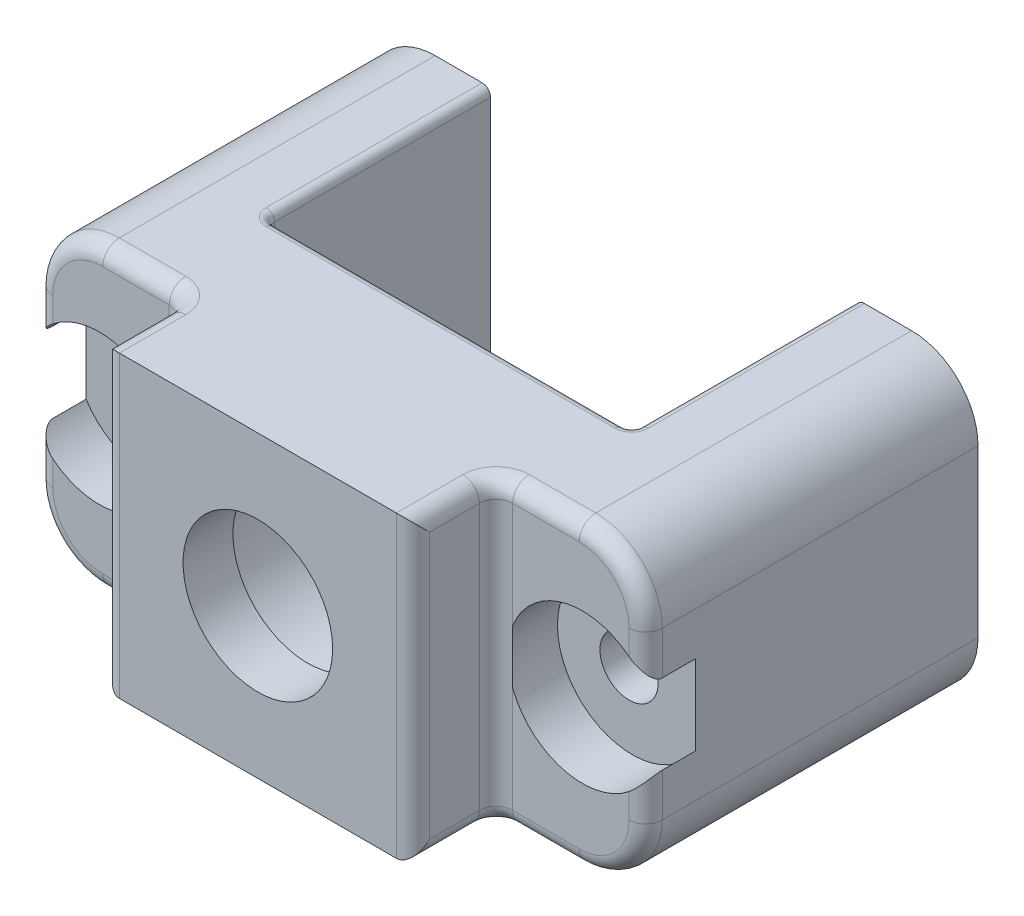
from build123d import *

# Parameters (mm, degrees)
SKETCH1_R            = 5.5
SKETCH1_R_2          = 1.75
BOSS_EXTRUDE1_DEPTH  = 15
SKETCH3_W            = 9.999397818
SKETCH3_H            = 22.225224056
CUT_EXTRUDE1_DEPTH   = 5
FILLET1_R            = 1
FILLET1_OF_MIRROR1_R = 1
SKETCH4_R            = 7.5
BOSS_EXTRUDE2_DEPTH  = 3
SKETCH5_W            = 22
SKETCH5_H            = 7
CUT_EXTRUDE2_DEPTH   = 30.75172255
SKETCH6_R            = 4.5
CUT_EXTRUDE3_DEPTH   = 26.34097462
SKETCH7_R            = 4.5
CUT_EXTRUDE8_DEPTH   = 3
FILLET3_R            = 0.5
FILLET2_R            = 0.5
BOSS_EXTRUDE3_START  = 10
SKETCH8_R            = 1.75
BOSS_EXTRUDE3_DEPTH  = 10


with BuildPart() as part:
    # Sketch1 → Boss-Extrude1 (new body)
    with BuildSketch(Plane.XY):
        with BuildLine():
            Line((-14.334802826, 9), (14.334802826, 9))
            ThreePointArc((14.334802826, 9), (17.163229951, 7.828427125), (18.334802826, 5))
            Line((18.334802826, 5), (18.334802826, -5))
            ThreePointArc((18.334802826, -5), (17.163229951, -7.828427125), (14.334802826, -9))
            Line((14.334802826, -9), (-14.334802826, -9))
            ThreePointArc((-14.334802826, -9), (-17.163229951, -7.828427125), (-18.334802826, -5))
            Line((-18.334802826, -5), (-18.334802826, 5))
            ThreePointArc((-18.334802826, 5), (-17.163229951, 7.828427125), (-14.334802826, 9))
        make_face()
        Circle(SKETCH1_R, mode=Mode.SUBTRACT)
        with Locations((-14.334802826, 0)):
            Circle(SKETCH1_R_2, mode=Mode.SUBTRACT)
        with Locations(Location((14.334802826, 0, 0), (0, 0, 180))):
            Circle(SKETCH1_R_2, mode=Mode.SUBTRACT)
    extrude(amount=BOSS_EXTRUDE1_DEPTH)

    # Sketch3 → Cut-Extrude1 (cut)
    with BuildSketch(Plane.XY.offset(15)):
        with Locations((-14.334501735, -0.429661625)):
            Rectangle(SKETCH3_W, SKETCH3_H)
    cut_extrude1 = extrude(amount=-CUT_EXTRUDE1_DEPTH, mode=Mode.SUBTRACT)

    # Fillet1
    fillet1_edges = [part.edges().sort_by_distance(p)[0] for p in [
        (-9.334802826, -9, 12.5),
        (-9.334802826, 0, 10),
        (-9.334802826, 9, 12.5),
        (-17.163229951, 7.828427125, 10),
        (-11.834802826, 9, 10),
        (-11.834802826, -9, 10),
        (-17.163229951, -7.828427125, 10),
        (-18.334802826, 0, 10),
        (-9.334802826, 0, 15),
    ]]
    fillet(fillet1_edges, radius=FILLET1_R)

    # Mirror1: Cut-Extrude1 across plane
    add(cut_extrude1.mirror(Plane(origin=(0, 0, 0), x_dir=(0, 0, 1), z_dir=(1, 0, 0))), mode=Mode.SUBTRACT)

    # Fillet1 of Mirror1
    fillet1_of_mirror1_edges = [part.edges().sort_by_distance(p)[0] for p in [
        (9.334802826, -9, 12.5),
        (9.334802826, 0, 10),
        (9.334802826, 9, 12.5),
        (17.163229951, 7.828427125, 10),
        (11.834802826, 9, 10),
        (11.834802826, -9, 10),
        (17.163229951, -7.828427125, 10),
        (18.334802826, 0, 10),
        (9.334802826, 0, 15),
    ]]
    fillet(fillet1_of_mirror1_edges, radius=FILLET1_OF_MIRROR1_R)

    # Sketch4 → Boss-Extrude2 (add)
    with BuildSketch(Plane.XY.offset(15)):
        Circle(SKETCH4_R)
    extrude(amount=-BOSS_EXTRUDE2_DEPTH)

    # Sketch5 → Cut-Extrude2 (cut, through all)
    with BuildSketch(Plane(origin=(0, 9, 0), x_dir=(1, 0, 0), z_dir=(0, 1, 0))):
        Rectangle(SKETCH5_W, SKETCH5_H)
    extrude(amount=-CUT_EXTRUDE2_DEPTH, mode=Mode.SUBTRACT)

    # Sketch6 → Cut-Extrude3 (cut, through all)
    with BuildSketch(Plane.XY.offset(15)):
        Circle(SKETCH6_R)
    extrude(amount=-CUT_EXTRUDE3_DEPTH, mode=Mode.SUBTRACT)

    # Sketch7 → Cut-Extrude8 (cut)
    with BuildSketch(Plane.XY.offset(10)):
        with Locations((-14.530374954, 0)):
            Circle(SKETCH7_R)
        with Locations((14.530374954, 0)):
            Circle(SKETCH7_R)
    extrude(amount=-CUT_EXTRUDE8_DEPTH, mode=Mode.SUBTRACT)

    # Fillet3
    fillet3_edges = [part.edges().sort_by_distance(p)[0] for p in [
        (11, -9, 1.75),
        (0, -9, 3.5),
        (11, 0, 3.5),
        (-11, -9, 1.75),
        (-11, 0, 3.5),
        (-11, 9, 1.75),
        (0, 9, 3.5),
        (11, 9, 1.75),
    ]]
    fillet(fillet3_edges, radius=FILLET3_R)

    # Fillet2
    fillet2_edges = [part.edges().sort_by_distance(p)[0] for p in [
        (-5.5, 0, 12),
    ]]
    fillet(fillet2_edges, radius=FILLET2_R)

    # Sketch8 → Boss-Extrude3 (add)
    # profile 1 of 2: a face of its own
    with BuildSketch(Plane(origin=(0, 0, 0), x_dir=(-1, 0, 0), z_dir=(0, 0, -1)).offset(BOSS_EXTRUDE3_START)):
        with BuildLine():
            Line((11, 8.5), (11, -8.5))
            ThreePointArc((11, -8.5), (11.146446609, -8.853553391), (11.5, -9))
            Line((11.5, -9), (14.334802826, -9))
            ThreePointArc((14.334802826, -9), (17.163229951, -7.828427125), (18.334802826, -5))
            Line((18.334802826, -5), (18.334802826, 5))
            ThreePointArc((18.334802826, 5), (17.163229951, 7.828427125), (14.334802826, 9))
            Line((14.334802826, 9), (11.5, 9))
            ThreePointArc((11.5, 9), (11.146446609, 8.853553391), (11, 8.5))
        make_face()
        with Locations((14.334802826, 0)):
            Circle(SKETCH8_R, mode=Mode.SUBTRACT)
    # profile 2 of 2: a face of its own
    with BuildSketch(Plane(origin=(0, 0, 0), x_dir=(-1, 0, 0), z_dir=(0, 0, -1)).offset(BOSS_EXTRUDE3_START)):
        with BuildLine():
            Line((-14.334802826, -9), (-11.5, -9))
            ThreePointArc((-11.5, -9), (-11.146446609, -8.853553391), (-11, -8.5))
            Line((-11, -8.5), (-11, 8.5))
            ThreePointArc((-11, 8.5), (-11.146446609, 8.853553391), (-11.5, 9))
            Line((-11.5, 9), (-14.334802826, 9))
            ThreePointArc((-14.334802826, 9), (-17.163229951, 7.828427125), (-18.334802826, 5))
            Line((-18.334802826, 5), (-18.334802826, -5))
            ThreePointArc((-18.334802826, -5), (-17.163229951, -7.828427125), (-14.334802826, -9))
        make_face()
        with Locations((-14.334802826, 0)):
            Circle(SKETCH8_R, mode=Mode.SUBTRACT)
    extrude(amount=-BOSS_EXTRUDE3_DEPTH)


solid = part.part
